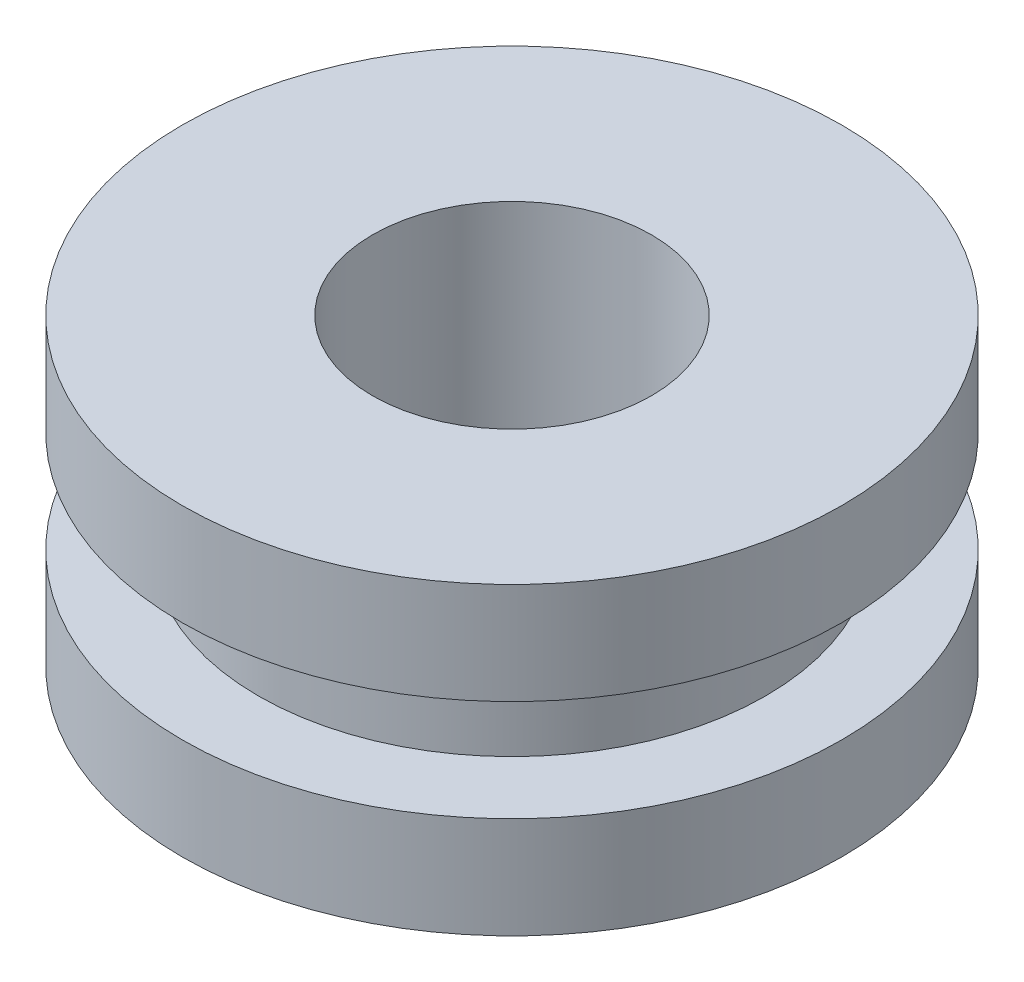
from build123d import *

# Parameters (mm, degrees)
SKIZZE1_R                       = 6.5
AUFSATZ_LINEAR_AUSTRAGEN1_DEPTH = 2
SKIZZE2_R                       = 5
AUFSATZ_LINEAR_AUSTRAGEN2_DEPTH = 1
SKIZZE3_R                       = 6.5
AUFSATZ_LINEAR_AUSTRAGEN3_DEPTH = 2
DURCHGANGSLOCH_F_R_M51_D        = 5.5


with BuildPart() as part:
    # Skizze1 → Aufsatz-Linear austragen1 (new body)
    with BuildSketch(Plane(origin=(0, 0, 0), x_dir=(1, 0, 0), z_dir=(0, 1, 0))):
        with Locations(Location((0, 0, 0), (0, 0, 270))):
            Circle(SKIZZE1_R)
    extrude(amount=AUFSATZ_LINEAR_AUSTRAGEN1_DEPTH)

    # Skizze2 → Aufsatz-Linear austragen2 (add)
    with BuildSketch(Plane(origin=(0, 2, 0), x_dir=(1, 0, 0), z_dir=(0, 1, 0))):
        with Locations(Location((0, 0, 0), (0, 0, 270))):
            Circle(SKIZZE2_R)
    aufsatz_linear_austragen2 = extrude(amount=AUFSATZ_LINEAR_AUSTRAGEN2_DEPTH)

    # Spiegeln3: Aufsatz-Linear austragen2 across plane
    add(aufsatz_linear_austragen2.mirror(Plane.ZX.offset(3)))

    # Skizze3 → Aufsatz-Linear austragen3 (add)
    with BuildSketch(Plane(origin=(0, 4, 0), x_dir=(1, 0, 0), z_dir=(0, 1, 0))):
        with Locations(Location((0, 0, 0), (0, 0, 270))):
            Circle(SKIZZE3_R)
    extrude(amount=AUFSATZ_LINEAR_AUSTRAGEN3_DEPTH)

    # Durchgangsloch für M51 (through all)
    with Locations(Plane(origin=(0, 6, 0), x_dir=(1, 0, 0), z_dir=(0, 1, 0))):
        with Locations((0, 0)):
            Hole(DURCHGANGSLOCH_F_R_M51_D / 2)


solid = part.part
